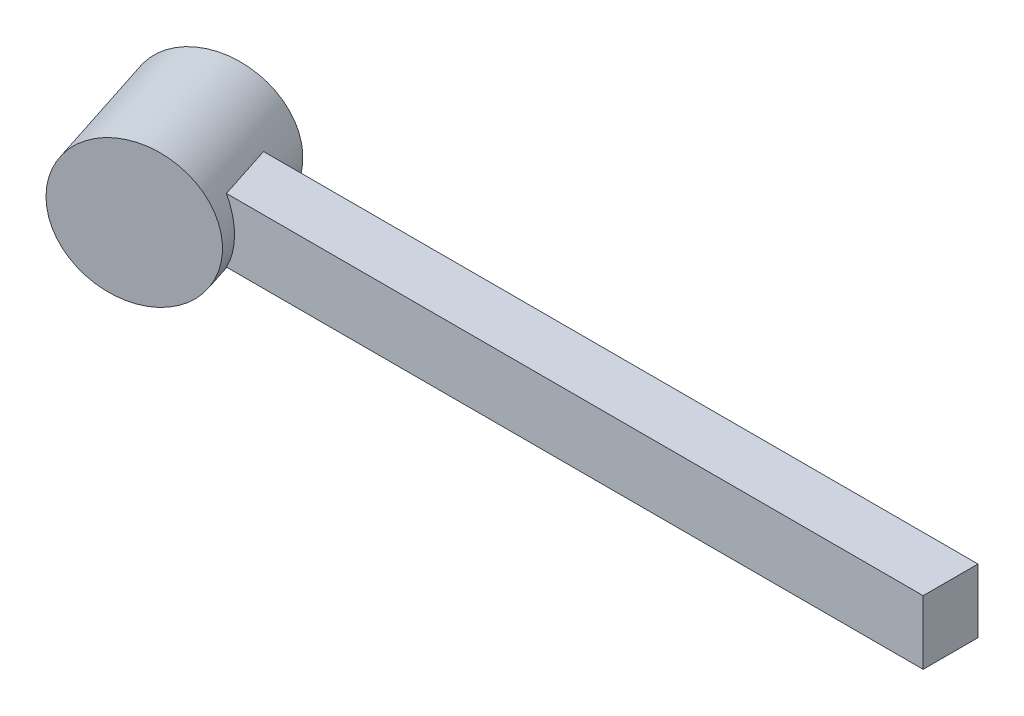
from build123d import *

# Parameters (mm, degrees)
SALIENTE_EXTRUIR1_DEPTH      = 1
SALIENTE_EXTRUIR1_DEPTH_BACK = 1
CROQUIS1_W                   = 25
CROQUIS1_H                   = 1.71875


with BuildPart() as part:
    # Croquis1 → Saliente-Extruir1 (new, two sides: drawn at the far end of the back side and taken through both)
    with BuildSketch(Plane(origin=(0, 0, 0), x_dir=(1, 0, 0), z_dir=(0, 1, 0)).offset(-SALIENTE_EXTRUIR1_DEPTH_BACK)):
        with Locations((5.703125, 0.859375)):
            Rectangle(CROQUIS1_W, CROQUIS1_H)
    extrude(amount=SALIENTE_EXTRUIR1_DEPTH + SALIENTE_EXTRUIR1_DEPTH_BACK)

    # Croquis2 → Revolución1 (revolve)
    with BuildSketch(Plane(origin=(0, 0, 0), x_dir=(1, 0, 0), z_dir=(0, 1, 0))):
        Polygon((-6.49264348, 2.492708525), (-8.58165548, 1.815986328), (-7.37467758, -1.909901974), (-5.285665579, -1.233179777), align=None)
    revolve(axis=Axis((-6.615873756, 0, -2.873115032), (0.3081770108524537, 0, 0.9513290335010526)))


solid = part.part
